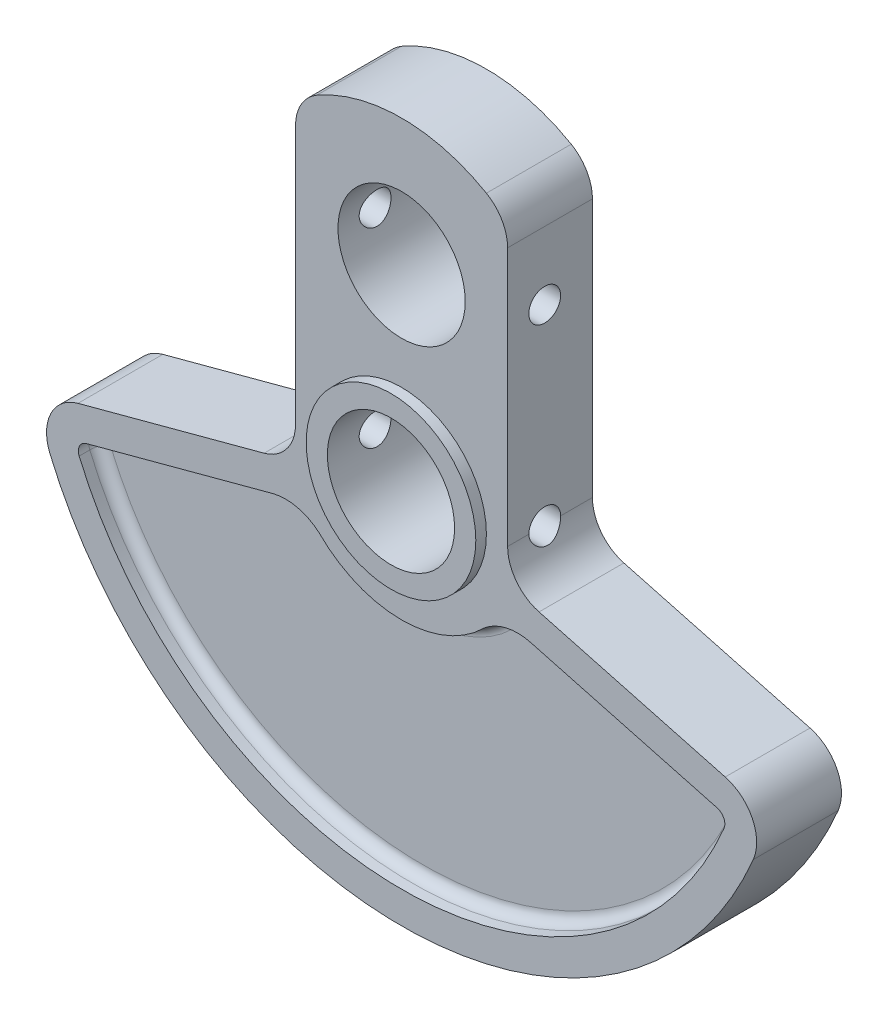
from build123d import *

# Parameters (mm, degrees)
SKETCH1_R           = 8
SKETCH1_R_2         = 6
BOSS_EXTRUDE2_DEPTH = 5
BOSS_EXTRUDE3_START = 4
SKETCH1_4_R         = 8
SKETCH1_4_R_2       = 6
BOSS_EXTRUDE3_DEPTH = 4
SKETCH1_8_R         = 8
SKETCH1_8_R_2       = 6
BOSS_EXTRUDE4_DEPTH = 4
SKETCH1_9_R         = 8
SKETCH1_9_R_2       = 6
BOSS_EXTRUDE5_DEPTH = 5
SKETCH1_10_R        = 8
BOSS_EXTRUDE6_DEPTH = 4
BOSS_EXTRUDE7_DEPTH = 2
SKETCH2_R           = 1.5
CUT_EXTRUDE1_DEPTH  = 74
FILLET2_R           = 1


with BuildPart() as part:
    # Sketch1 → Boss-Extrude2 (new body)
    with BuildSketch(Plane.XY):
        with Locations((0, 18)):
            Circle(SKETCH1_R)
        with Locations((0, 18)):
            Circle(SKETCH1_R_2, mode=Mode.SUBTRACT)
    extrude(amount=-BOSS_EXTRUDE2_DEPTH)

    # Sketch1<4> → Boss-Extrude3 (add)
    with BuildSketch(Plane.XY.offset(BOSS_EXTRUDE3_START)):
        with Locations((0, 18)):
            Circle(SKETCH1_4_R)
        with Locations((0, 18)):
            Circle(SKETCH1_4_R_2, mode=Mode.SUBTRACT)
    extrude(amount=-BOSS_EXTRUDE3_DEPTH)



with BuildPart() as body_2:
    # Sketch1<8> → Boss-Extrude4 (new body)
    with BuildSketch(Plane.XY):
        Circle(SKETCH1_8_R)
        Circle(SKETCH1_8_R_2, mode=Mode.SUBTRACT)
    extrude(amount=-BOSS_EXTRUDE4_DEPTH)

    # Sketch1<9> → Boss-Extrude5 (add)
    with BuildSketch(Plane.XY):
        Circle(SKETCH1_9_R)
        Circle(SKETCH1_9_R_2, mode=Mode.SUBTRACT)
    extrude(amount=BOSS_EXTRUDE5_DEPTH)


with BuildPart() as part_1:
    add(part.part)

    add(body_2.part)  # Boss-Extrude6 merges body 2
    # Sketch1<10> → Boss-Extrude6 (add, symmetric)
    with BuildSketch(Plane.XY):
        with BuildLine():
            Line((10, 0), (10, 24.392304845))
            ThreePointArc((10, 24.392304845), (9.464101615, 26.392304845), (8, 27.856406461))
            ThreePointArc((8, 27.856406461), (0, 30), (-8, 27.856406461))
            ThreePointArc((-8, 27.856406461), (-9.464101615, 26.392304845), (-10, 24.392304845))
            Line((-10, 24.392304845), (-10, 0))
            ThreePointArc((-10, 0), (-10.826586639, -2.435045716), (-12.96472382, -3.863703305))
            Line((-12.96472382, -3.863703305), (-30.521723645, -8.56808723))
            ThreePointArc((-30.521723645, -8.56808723), (-33.079490803, -10.673939697), (-33.172253398, -13.985764352))
            ThreePointArc((-33.172253398, -13.985764352), (0, -36), (33.172253398, -13.985764352))
            ThreePointArc((33.172253398, -13.985764352), (33.079490803, -10.673939697), (30.521723645, -8.56808723))
            Line((30.521723645, -8.56808723), (12.96472382, -3.863703305))
            ThreePointArc((12.96472382, -3.863703305), (10.826586639, -2.435045716), (10, 0))
        make_face()
        with BuildLine():
            Line((-29.74526651, -11.465864709), (-12.188266684, -6.761480784))
            ThreePointArc((-12.188266684, -6.761480784), (-9.876608994, -6.714952527), (-7.808142843, -7.748090432))
            ThreePointArc((-7.808142843, -7.748090432), (0, -11), (7.808142843, -7.748090432))
            ThreePointArc((7.808142843, -7.748090432), (9.876608994, -6.714952527), (12.188266684, -6.761480784))
            Line((12.188266684, -6.761480784), (29.74526651, -11.465864709))
            ThreePointArc((29.74526651, -11.465864709), (30.384708299, -11.992327826), (30.407898948, -12.820283989))
            ThreePointArc((30.407898948, -12.820283989), (0, -33), (-30.407898948, -12.820283989))
            ThreePointArc((-30.407898948, -12.820283989), (-30.384708299, -11.992327826), (-29.74526651, -11.465864709))
        make_face(mode=Mode.SUBTRACT)
        Circle(SKETCH1_10_R, mode=Mode.SUBTRACT)
        with Locations((0, 18)):
            Circle(SKETCH1_10_R, mode=Mode.SUBTRACT)
    extrude(amount=BOSS_EXTRUDE6_DEPTH, both=True)

    # Sketch1<11> → Boss-Extrude7 (add, symmetric)
    with BuildSketch(Plane.XY):
        with BuildLine():
            ThreePointArc((-7.808142843, -7.748090432), (-9.876608994, -6.714952527), (-12.188266684, -6.761480784))
            Line((-12.188266684, -6.761480784), (-29.74526651, -11.465864709))
            ThreePointArc((-29.74526651, -11.465864709), (-30.384708299, -11.992327826), (-30.407898948, -12.820283989))
            ThreePointArc((-30.407898948, -12.820283989), (0, -33), (30.407898948, -12.820283989))
            ThreePointArc((30.407898948, -12.820283989), (30.384708299, -11.992327826), (29.74526651, -11.465864709))
            Line((29.74526651, -11.465864709), (12.188266684, -6.761480784))
            ThreePointArc((12.188266684, -6.761480784), (9.876608994, -6.714952527), (7.808142843, -7.748090432))
            ThreePointArc((7.808142843, -7.748090432), (0, -11), (-7.808142843, -7.748090432))
        make_face()
    extrude(amount=BOSS_EXTRUDE7_DEPTH, both=True)

    # Sketch2 → Cut-Extrude1 (cut, symmetric)
    with BuildSketch(Plane(origin=(0, 0, 0), x_dir=(0, 0, -1), z_dir=(1, 0, 0))):
        with Locations((-0.5, 18)):
            Circle(SKETCH2_R)
        with Locations((-0.5, 0)):
            Circle(SKETCH2_R)
    extrude(amount=CUT_EXTRUDE1_DEPTH, both=True, mode=Mode.SUBTRACT)

    # Fillet2
    fillet2_edges = [part_1.edges().sort_by_distance(p)[0] for p in [
        (30.384708299, -11.992327826, 2),
        (0, -33, 2),
        (-30.384708299, -11.992327826, 2),
        (-20.966766597, -9.113672746, 2),
        (-9.876608994, -6.714952527, 2),
        (0, -11, 2),
        (9.876608994, -6.714952527, 2),
        (20.966766597, -9.113672746, 2),
    ]]
    fillet(fillet2_edges, radius=FILLET2_R)


solid = part_1.part
